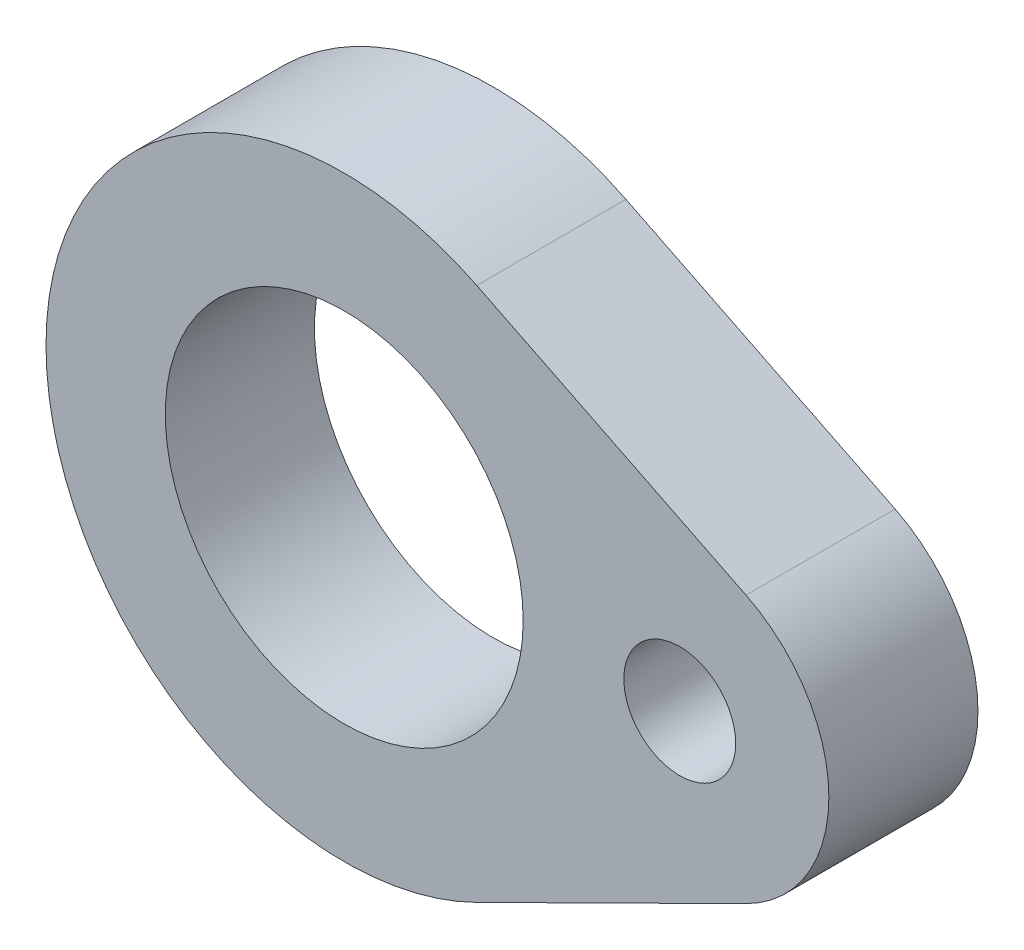
from build123d import *

# Parameters (mm, degrees)
SKETCH1_R           = 2.4
SKETCH1_R_2         = 0.75
BOSS_EXTRUDE1_DEPTH = 1


with BuildPart() as part:
    # Sketch1 → Boss-Extrude1 (new, symmetric)
    with BuildSketch(Plane.XY):
        with BuildLine():
            Line((1.777777778, 3.583225666), (5.388888889, 1.791612833))
            ThreePointArc((5.388888889, 1.791612833), (6.5, 0), (5.388888889, -1.791612833))
            Line((5.388888889, -1.791612833), (1.777777778, -3.583225666))
            ThreePointArc((1.777777778, -3.583225666), (-4, 0), (1.777777778, 3.583225666))
        make_face()
        Circle(SKETCH1_R, mode=Mode.SUBTRACT)
        with Locations((4.5, 0)):
            Circle(SKETCH1_R_2, mode=Mode.SUBTRACT)
    extrude(amount=BOSS_EXTRUDE1_DEPTH, both=True)


solid = part.part
